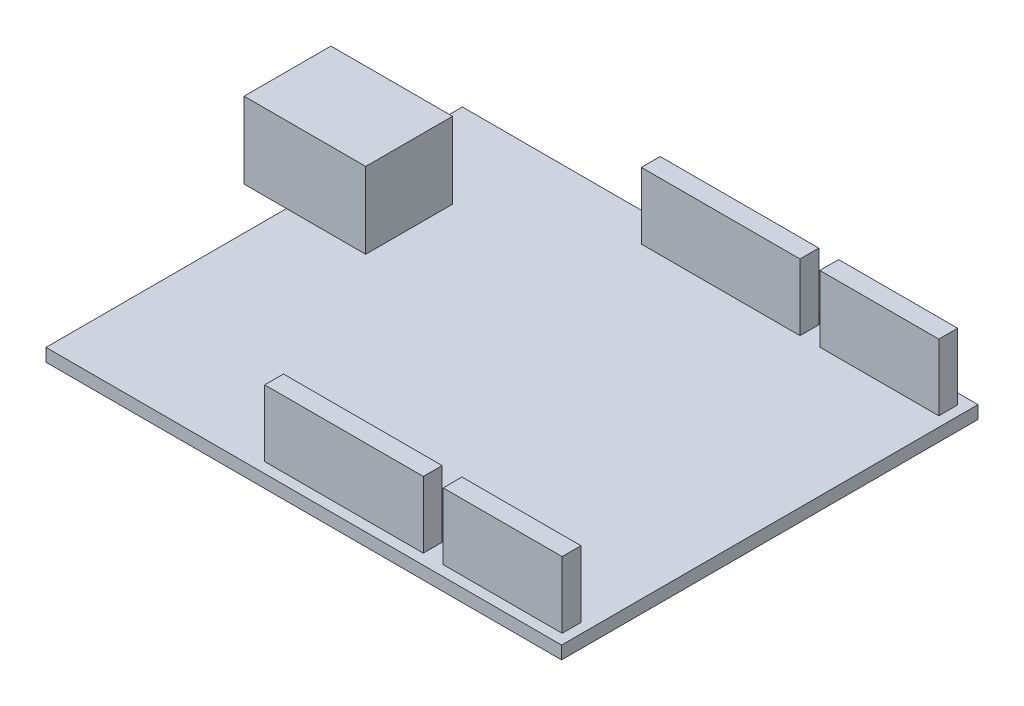
from build123d import *

# Parameters (mm, degrees)
SKETCH2_W           = 66.04
SKETCH2_H           = 53.34
BOSS_EXTRUDE1_DEPTH = 1.65
SKETCH3_W           = 15.58
SKETCH3_H           = 11.12
BOSS_EXTRUDE2_DEPTH = 9.75
SKETCH4_W           = 8.3
SKETCH4_H           = 7.204134494
SKETCH4_W_2         = 5.16
SKETCH4_H_2         = 2.74
CUT_EXTRUDE1_DEPTH  = 9.75
SKETCH5_W           = 15.24
SKETCH5_H           = 2.41
SKETCH5_W_2         = 20.32
BOSS_EXTRUDE3_DEPTH = 8.51


with BuildPart() as part:
    # Sketch2 → Boss-Extrude1 (new body)
    with BuildSketch(Plane(origin=(0, 0, 0), x_dir=(1, 0, 0), z_dir=(0, 1, 0))):
        Rectangle(SKETCH2_W, SKETCH2_H)
    extrude(amount=BOSS_EXTRUDE1_DEPTH)

    # Sketch3 → Boss-Extrude2 (add)
    with BuildSketch(Plane(origin=(0, 1.65, 0), x_dir=(1, 0, 0), z_dir=(0, 1, 0))):
        with Locations((-30.66, 9.691373861)):
            Rectangle(SKETCH3_W, SKETCH3_H)
    extrude(amount=BOSS_EXTRUDE2_DEPTH)

    # Sketch4 → Cut-Extrude1 (cut)
    with BuildSketch(Plane.ZY.offset(38.45)):
        with Locations((-9.681373861, 6.202067247)):
            Rectangle(SKETCH4_W, SKETCH4_H)
        with Locations((-9.681373861, 6.202067247)):
            Rectangle(SKETCH4_W_2, SKETCH4_H_2, mode=Mode.SUBTRACT)
    extrude(amount=-CUT_EXTRUDE1_DEPTH, mode=Mode.SUBTRACT)

    # Sketch5 → Boss-Extrude3 (add)
    with BuildSketch(Plane(origin=(0, 1.65, 0), x_dir=(1, 0, 0), z_dir=(0, 1, 0))):
        with Locations((24.13, -24.125)):
            Rectangle(SKETCH5_W, SKETCH5_H)
        with Locations((3.81, -24.125)):
            Rectangle(SKETCH5_W_2, SKETCH5_H)
        with Locations((24.13, 24.125)):
            Rectangle(SKETCH5_W, SKETCH5_H)
        with Locations((3.81, 24.125)):
            Rectangle(SKETCH5_W_2, SKETCH5_H)
    extrude(amount=BOSS_EXTRUDE3_DEPTH)


solid = part.part
